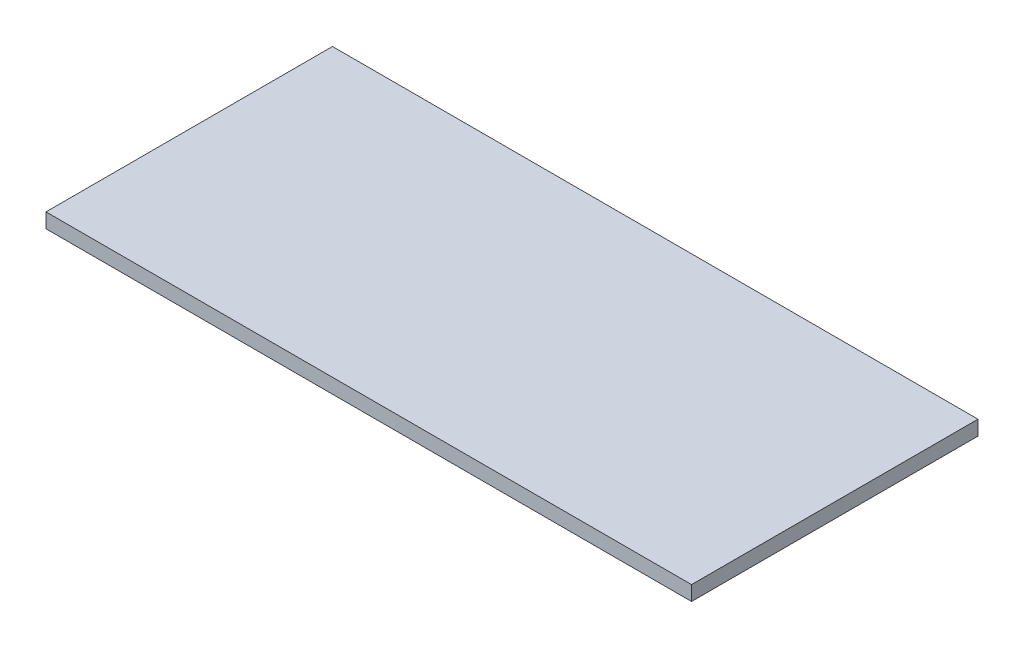
from build123d import *

# Parameters (mm, degrees)
CROQUIS1_W              = 88
CROQUIS1_H              = 39.05
SALIENTE_EXTRUIR1_DEPTH = 2


with BuildPart() as part:
    # Croquis1 → Saliente-Extruir1 (new body)
    with BuildSketch(Plane(origin=(0, 0, 0), x_dir=(1, 0, 0), z_dir=(0, 1, 0))):
        Rectangle(CROQUIS1_W, CROQUIS1_H)
    extrude(amount=SALIENTE_EXTRUIR1_DEPTH)


solid = part.part
